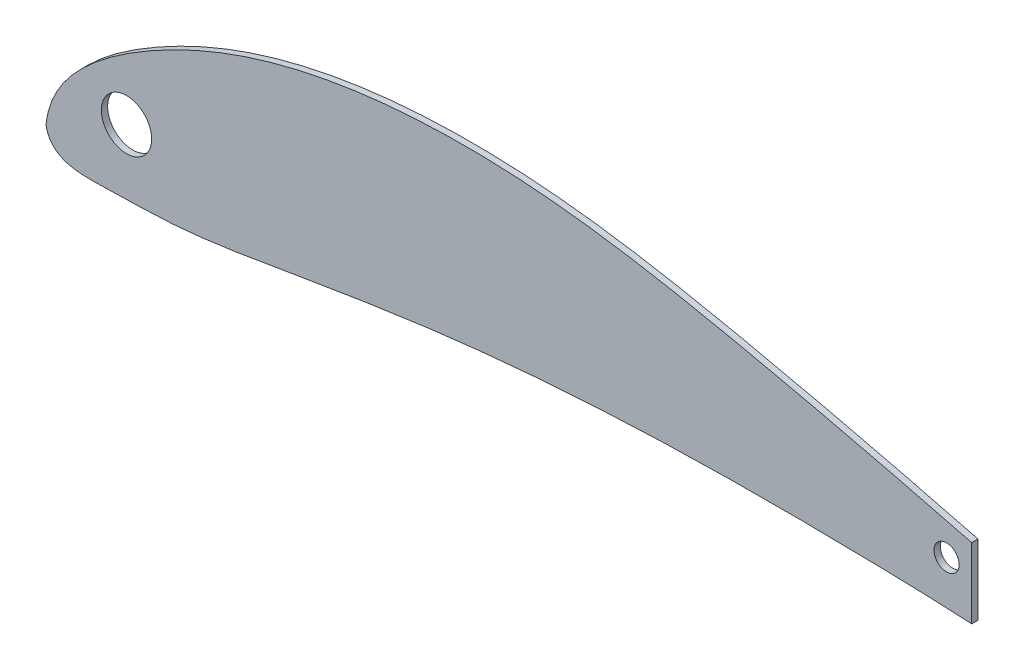
from build123d import *

# Parameters (mm, degrees)
BOSS_EXTRUDE1_DEPTH = 1.5875
SKETCH2_R           = 6.35
SKETCH2_R_2         = 3.175
CUT_EXTRUDE1_DEPTH  = 316.731983488
SKETCH3_W           = 116.84
SKETCH3_H           = 50.8
CUT_EXTRUDE2_DEPTH  = 316.731983488


with BuildPart() as part:
    # Sketch1 → Boss-Extrude1 (new body)
    with BuildSketch(Plane.XY):
        with BuildLine():
            add(Edge.make_bspline(
                [(0.000560351, 0.000130087), (0.810633127, 7.359196055), (8.649092025, 17.856605174), (26.286719818, 29.975176328), (52.111128271, 42.069215275), (89.597618475, 49.290763054), (131.400792109, 47.884831915), (173.256699242, 40.041104278), (217.961060472, 29.612974894), (256.952064401, 19.528920948), (290.35983767, 8.71099439), (301.273197721, 4.382828139), (314.816918223, -0.516206742), (309.846313895, 0.000130087)],
                knots=[0, 0, 0, 0, 0.060863618, 0.113688265, 0.188608742, 0.312908923, 0.448482434, 0.557612135, 0.691544113, 0.852438279, 0.92975597, 0.976058229, 1, 1, 1, 1], degree=3))
            add(Edge.make_bspline(
                [(309.846313895, 0.000130087), (303.956832565, 1.47095521), (293.989507544, 2.093987313), (276.26402299, 4.514356704), (260.846344817, 5.427413394), (235.858814759, 7.870306192), (205.101424636, 8.838080282), (157.718638092, 9.030650149), (110.497331172, 6.181495223), (66.506197185, -0.586669107), (36.454672816, -6.098499901), (15.316603331, -6.189065841), (1.230714189, -6.924076091), (0.000560351, 0.000130087)],
                knots=[0, 0, 0, 0, 0.057787081, 0.095274891, 0.171021118, 0.205339302, 0.335319146, 0.464904334, 0.658702312, 0.785511947, 0.893517288, 0.94309214, 1, 1, 1, 1], degree=3))
        make_face()
    extrude(amount=BOSS_EXTRUDE1_DEPTH)

    # Sketch2 → Cut-Extrude1 (cut, through all)
    with BuildSketch(Plane.XY.offset(1.5875)):
        with Locations((20.32, 10.16)):
            Circle(SKETCH2_R)
        with Locations((227.296313895, 19.050130087)):
            Circle(SKETCH2_R_2)
    extrude(amount=-CUT_EXTRUDE1_DEPTH, mode=Mode.SUBTRACT)

    # Sketch3 → Cut-Extrude2 (cut, through all)
    with BuildSketch(Plane.XY.offset(1.5875)):
        with Locations((292.066313895, 19.050130087)):
            Rectangle(SKETCH3_W, SKETCH3_H)
    extrude(amount=-CUT_EXTRUDE2_DEPTH, mode=Mode.SUBTRACT)


solid = part.part
